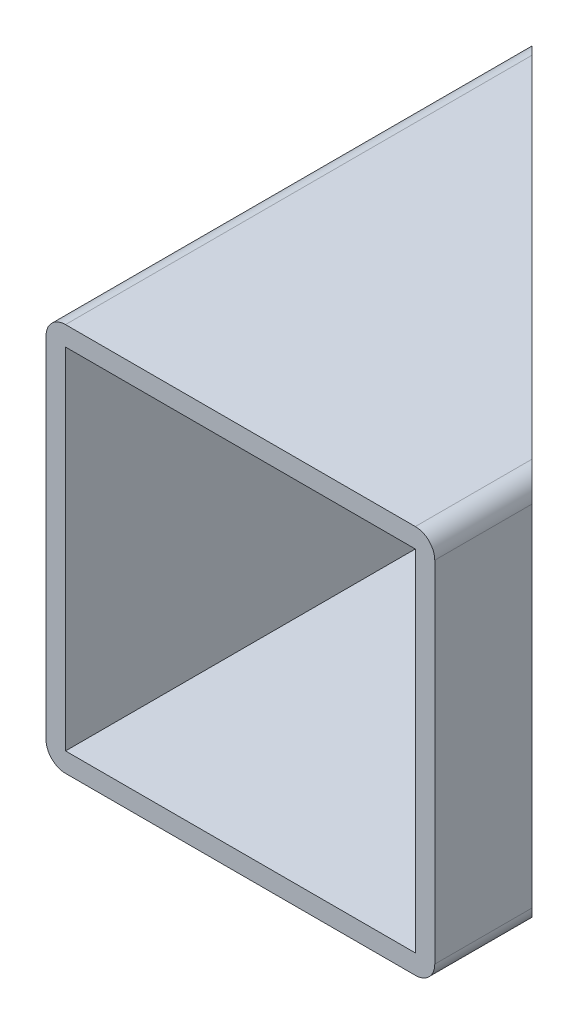
from build123d import *

# Parameters (mm, degrees)
IZIM1_W                     = 72
IZIM1_H                     = 72
Y_KSEKLIK_EKSTR_ZYON1_DEPTH = 100
KES_EKSTR_ZYON2_DEPTH       = 67
KES_EKSTR_ZYON2_DEPTH_BACK  = 90


with BuildPart() as part:
    # Çizim1 → Yükseklik-Ekstrüzyon1 (new body)
    with BuildSketch(Plane.XY):
        with BuildLine():
            Line((-36, 40), (36, 40))
            ThreePointArc((36, 40), (38.828427125, 38.828427125), (40, 36))
            Line((40, 36), (40, -36))
            ThreePointArc((40, -36), (38.828427125, -38.828427125), (36, -40))
            Line((36, -40), (-36, -40))
            ThreePointArc((-36, -40), (-38.828427125, -38.828427125), (-40, -36))
            Line((-40, -36), (-40, 36))
            ThreePointArc((-40, 36), (-38.828427125, 38.828427125), (-36, 40))
        make_face()
        Rectangle(IZIM1_W, IZIM1_H, mode=Mode.SUBTRACT)
    extrude(amount=Y_KSEKLIK_EKSTR_ZYON1_DEPTH)

    # Çizim4 → Kes-Ekstrüzyon2 (cut, two sides: drawn at the far end of the back side and taken through both)
    with BuildSketch(Plane(origin=(0, 0, 0), x_dir=(1, 0, 0), z_dir=(0, 1, 0)).offset(-KES_EKSTR_ZYON2_DEPTH_BACK)):
        Polygon((-40, 0), (40, -80), (40, 0), align=None)
    extrude(amount=KES_EKSTR_ZYON2_DEPTH + KES_EKSTR_ZYON2_DEPTH_BACK, mode=Mode.SUBTRACT)


solid = part.part
